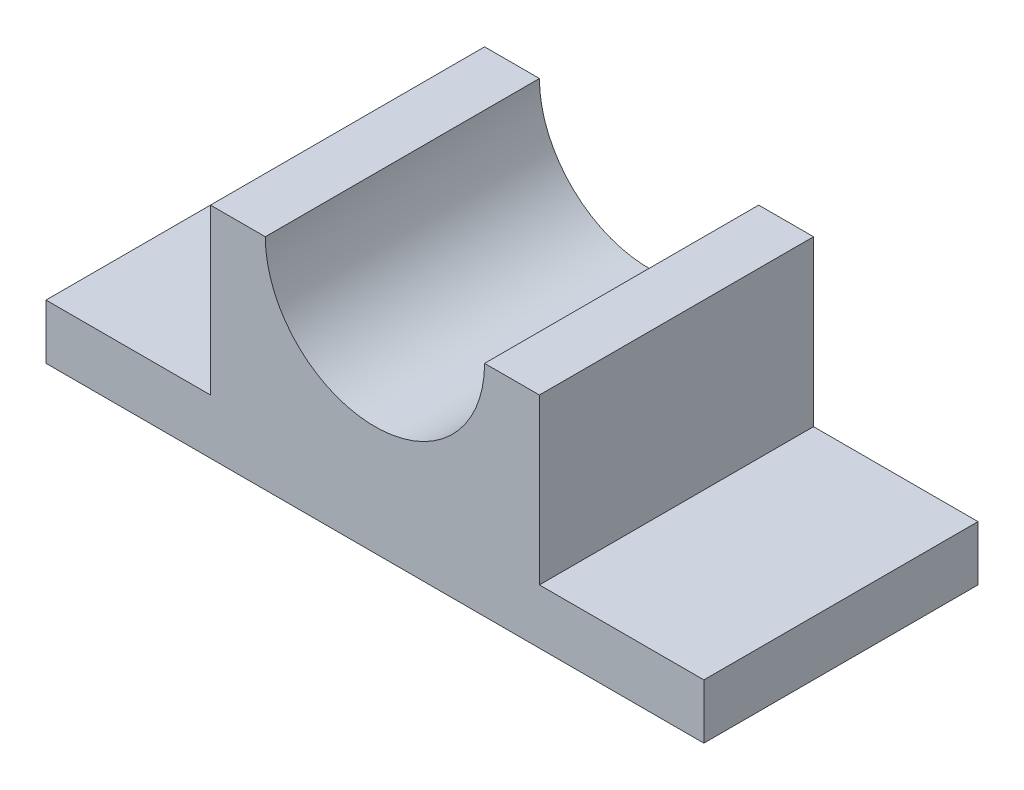
from build123d import *

# Parameters (mm, degrees)
BOSS_EXTRUDE1_DEPTH = 31.75


with BuildPart() as part:
    # Sketch2 → Boss-Extrude1 (new, symmetric)
    with BuildSketch(Plane.XY):
        with BuildLine():
            Line((-25.4, 50.8), (-38.1, 50.8))
            Line((-38.1, 50.8), (-38.1, 12.7))
            Line((-38.1, 12.7), (-76.2, 12.7))
            Line((-76.2, 12.7), (-76.2, 0))
            Line((-76.2, 0), (76.2, 0))
            Line((76.2, 0), (76.2, 12.7))
            Line((76.2, 12.7), (38.1, 12.7))
            Line((38.1, 12.7), (38.1, 50.8))
            Line((38.1, 50.8), (25.4, 50.8))
            ThreePointArc((25.4, 50.8), (0, 25.4), (-25.4, 50.8))
        make_face()
    extrude(amount=BOSS_EXTRUDE1_DEPTH, both=True)


solid = part.part
